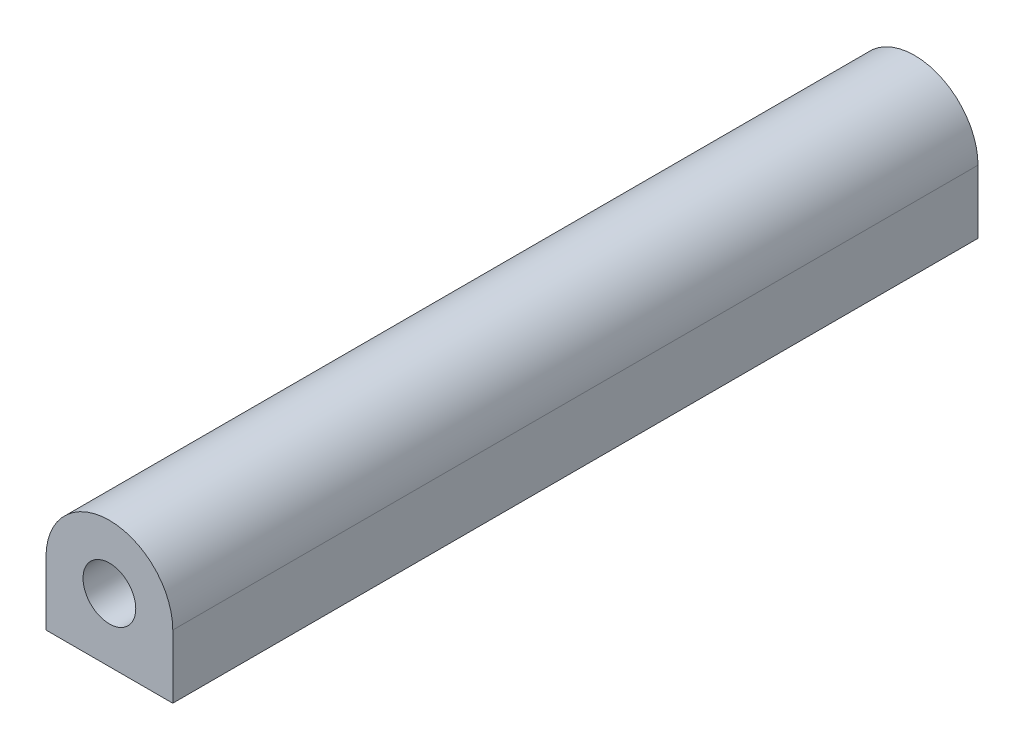
from build123d import *

# Parameters (mm, degrees)
SKETCH1_R           = 3.425
BOSS_EXTRUDE1_DEPTH = 43.5096
SKETCH2_R           = 1.475
CUT_EXTRUDE1_DEPTH  = 10
SKETCH3_R           = 1.425
CUT_EXTRUDE2_DEPTH  = 10
BOSS_EXTRUDE2_START = -43.5096
BOSS_EXTRUDE2_DEPTH = 43.5096


with BuildPart() as part:
    # Sketch1 → Boss-Extrude1 (new body)
    with BuildSketch(Plane.XY):
        Circle(SKETCH1_R)
    extrude(amount=BOSS_EXTRUDE1_DEPTH)

    # Sketch2 → Cut-Extrude1 (cut)
    with BuildSketch(Plane(origin=(0, 0, 0), x_dir=(-1, 0, 0), z_dir=(0, 0, -1))):
        Circle(SKETCH2_R)
    extrude(amount=-CUT_EXTRUDE1_DEPTH, mode=Mode.SUBTRACT)

    # Sketch3 → Cut-Extrude2 (cut)
    with BuildSketch(Plane.XY.offset(43.5096)):
        Circle(SKETCH3_R)
    extrude(amount=-CUT_EXTRUDE2_DEPTH, mode=Mode.SUBTRACT)

    # Sketch4 → Boss-Extrude2 (add)
    with BuildSketch(Plane.XY.offset(43.5096).offset(BOSS_EXTRUDE2_START)):
        with BuildLine():
            Line((-3.425, -3.425), (0, -3.425))
            ThreePointArc((0, -3.425), (-2.421840726, -2.421840726), (-3.425, 0))
            Line((-3.425, 0), (-3.425, -3.425))
        make_face()
        with BuildLine():
            ThreePointArc((3.425, 0), (2.421840726, -2.421840726), (0, -3.425))
            Line((0, -3.425), (1.146126532, -3.425))
            Line((1.146126532, -3.425), (3.425, -3.425))
            Line((3.425, -3.425), (3.425, 0))
        make_face()
    extrude(amount=BOSS_EXTRUDE2_DEPTH)


solid = part.part
